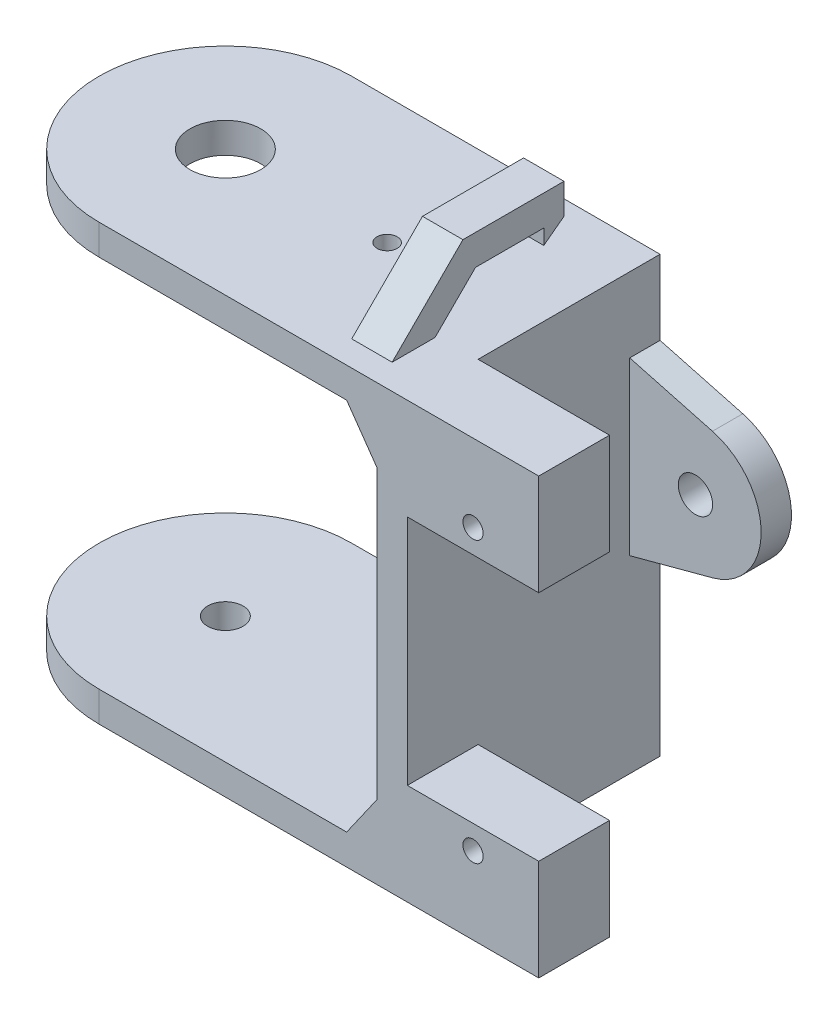
from build123d import *
from OCP.BRepFilletAPI import BRepFilletAPI_MakeChamfer

# Parameters (mm, degrees)
ESBO_O1_R                  = 1
RESSALTO_EXTRUS_O1_DEPTH   = 12.5
ESBO_O2_R                  = 3.5
ESBO_O2_R_2                = 1
CORTE_EXTRUS_O1_DEPTH      = 15
CORTE_EXTRUS_O2_DEPTH      = 56.625983137
CORTE_EXTRUS_O2_DEPTH_BACK = 56.625983137
ESBO_O4_W                  = 13
ESBO_O4_H                  = 18
ESBO_O5_R                  = 1.7
RESSALTO_EXTRUS_O2_DEPTH   = 3
CHANFRO1_SIZE              = 3
CHANFRO1_SIZE2             = 4.28444402
ESBO_O7_R                  = 1.75
CORTE_EXTRUS_O3_DEPTH      = 10
CORTE_EXTRUS_O4_DEPTH      = 63.08260626
RESSALTO_EXTRUS_O3_START   = -4
RESSALTO_EXTRUS_O3_DEPTH   = 4


with BuildPart() as part:
    # Esboço1 → Ressalto-extrusão1 (new, symmetric)
    with BuildSketch(Plane.XY):
        Polygon((0, -21.5), (-43, -21.5), (-43, -18.5), (-3, -18.5), (-3, 18.5), (-43, 18.5), (-43, 21.5), (0, 21.5), (13, 21.5), (13, 11.5), (0, 11.5), (0, -11.5), (13, -11.5), (13, -21.5), align=None)
        with Locations((6.5, 13.85)):
            Circle(ESBO_O1_R, mode=Mode.SUBTRACT)
        with Locations((6.5, -13.85)):
            Circle(ESBO_O1_R, mode=Mode.SUBTRACT)
    extrude(amount=RESSALTO_EXTRUS_O1_DEPTH, both=True)

    # Esboço2 → Corte-extrusão1 (cut)
    with BuildSketch(Plane(origin=(0, 21.5, 0), x_dir=(1, 0, 0), z_dir=(0, 1, 0))):
        with Locations((-30.5, 0)):
            Circle(ESBO_O2_R)
        with Locations((-14.5, 0)):
            Circle(ESBO_O2_R_2)
        with BuildLine():
            Line((-30.5, 12.5), (-64.159261009, 12.5))
            Line((-64.159261009, 12.5), (-64.159261009, -12.5))
            Line((-64.159261009, -12.5), (-30.5, -12.5))
            ThreePointArc((-30.5, -12.5), (-43, 0), (-30.5, 12.5))
        make_face()
    extrude(amount=-CORTE_EXTRUS_O1_DEPTH, mode=Mode.SUBTRACT)

    # Esboço4 → Corte-extrusão2 (cut, two sides: drawn at the far end of the back side and taken through both)
    with BuildSketch(Plane(origin=(0, -11.5, 0), x_dir=(1, 0, 0), z_dir=(0, 1, 0)).offset(-CORTE_EXTRUS_O2_DEPTH_BACK)):
        with Locations((6.5, 3.5)):
            Rectangle(ESBO_O4_W, ESBO_O4_H)
    extrude(amount=CORTE_EXTRUS_O2_DEPTH + CORTE_EXTRUS_O2_DEPTH_BACK, mode=Mode.SUBTRACT)

    # Esboço5 → Ressalto-extrusão2 (add)
    with BuildSketch(Plane(origin=(0, 0, -12.5), x_dir=(-1, 0, 0), z_dir=(0, 0, -1))):
        with BuildLine():
            Line((-8.182323793, 11.928517871), (0, 14.120964923))
            Line((0, 14.120964923), (0, -2.820964923))
            Line((0, -2.820964923), (-8.182323793, -0.628517871))
            ThreePointArc((-8.182323793, -0.628517871), (-13, 5.65), (-8.182323793, 11.928517871))
        make_face()
        with Locations((-6.5, 5.65)):
            Circle(ESBO_O5_R, mode=Mode.SUBTRACT)
    extrude(amount=-RESSALTO_EXTRUS_O2_DEPTH)

    # Chanfro1: one chamfer whose edges measure the first distance from different faces: ONE call of the kernel's chamfer builder (chamfer() names one face for all edges)
    chanfro1_edges_1 = [part.edges().sort_by_distance(p)[0] for p in [
        (-3, -18.5, 0),
    ]]
    chanfro1_side_1 = [part.faces().sort_by_distance(p)[0] for p in [
        (-23, -18.5, 0),
    ]]
    chanfro1_edges_2 = [part.edges().sort_by_distance(p)[0] for p in [
        (-3, 18.5, 0),
    ]]
    chanfro1_side_2 = [part.faces().sort_by_distance(p)[0] for p in [
        (-21.411390312, 18.5, 0),
    ]]
    chanfro1 = BRepFilletAPI_MakeChamfer(part.part.solid().wrapped)
    for e in chanfro1_edges_1:
        chanfro1.Add(CHANFRO1_SIZE, CHANFRO1_SIZE2, e.wrapped, chanfro1_side_1[0].wrapped)  # the first distance lies on this face
    for e in chanfro1_edges_2:
        chanfro1.Add(CHANFRO1_SIZE, CHANFRO1_SIZE2, e.wrapped, chanfro1_side_2[0].wrapped)  # the first distance lies on this face
    add(Compound.cast(chanfro1.Shape()), mode=Mode.REPLACE)

    # Esboço7 → Corte-extrusão3 (cut)
    with BuildSketch(Plane(origin=(0, -18.5, 0), x_dir=(1, 0, 0), z_dir=(0, 1, 0))):
        with Locations((-30.5, 0)):
            Circle(ESBO_O7_R)
    extrude(amount=-CORTE_EXTRUS_O3_DEPTH, mode=Mode.SUBTRACT)

    # Esboço2<2> → Corte-extrusão4 (cut, through all)
    with BuildSketch(Plane(origin=(0, 21.5, 0), x_dir=(1, 0, 0), z_dir=(0, 1, 0))):
        with BuildLine():
            Line((-30.5, 12.5), (-64.159261009, 12.5))
            Line((-64.159261009, 12.5), (-64.159261009, -12.5))
            Line((-64.159261009, -12.5), (-30.5, -12.5))
            ThreePointArc((-30.5, -12.5), (-43, 0), (-30.5, 12.5))
        make_face()
    extrude(amount=-CORTE_EXTRUS_O4_DEPTH, mode=Mode.SUBTRACT)

    # Esboço8 → Ressalto-extrusão3 (add)
    with BuildSketch(Plane(origin=(0, 0, 0), x_dir=(0, 0, -1), z_dir=(1, 0, 0)).offset(RESSALTO_EXTRUS_O3_START)):
        Polygon((-10, 21.5), (-3, 28.5), (7, 28.5), (7, 25.5), (5, 24), (5, 25.5), (-1.757359313, 25.5), (-5.757359313, 21.5), align=None)
    extrude(amount=-RESSALTO_EXTRUS_O3_DEPTH)


solid = part.part
